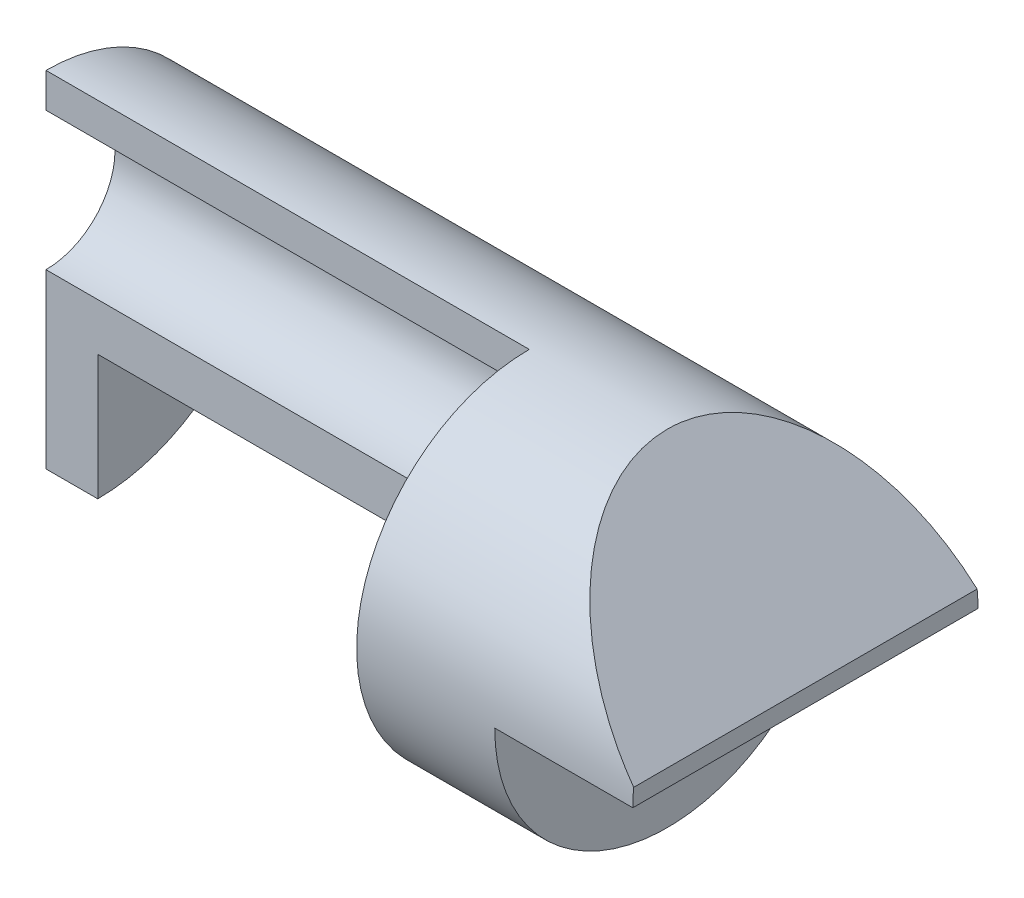
from build123d import *

# Parameters (mm, degrees)
SKETCH_1_W               = 22
SKETCH_1_H               = 5
CUT_EXTRUDE_1_DEPTH      = 24.108440017
CUT_EXTRUDE_1_DEPTH_BACK = 24.108440017
SKETCH_3_W               = 4
SKETCH_3_H               = 5
CUT_EXTRUDE_4_DEPTH      = 24.108440017
CUT_EXTRUDE_4_DEPTH_BACK = 24.108440017
SKETCH_4_W               = 14
SKETCH_4_H               = 5
CUT_EXTRUDE_5_DEPTH      = 24.108440017
CUT_EXTRUDE_5_DEPTH_BACK = 16
SKETCH_5_R               = 2
SKETCH_6_W               = 10.5
SKETCH_6_H               = 3.627911102
CUT_EXTRUDE_6_DEPTH      = 16


with BuildPart() as part:
    # 草图1 → 旋转1 (revolve)
    with BuildSketch(Plane.XY):
        with Locations((11, 2.5)):
            Rectangle(SKETCH_1_W, SKETCH_1_H)
    revolve(axis=Axis((22, 0, 0), (-1, 0, 0)))

    # 草图3 → 切除-拉伸1 (cut, two sides: drawn at the far end of the back side and taken through both)
    with BuildSketch(Plane.XY.offset(-CUT_EXTRUDE_1_DEPTH_BACK)):
        with Locations((20, -2.5)):
            Rectangle(SKETCH_3_W, SKETCH_3_H)
        Polygon((22, 0.5), (18, 5), (22, 5), align=None)
    extrude(amount=CUT_EXTRUDE_1_DEPTH + CUT_EXTRUDE_1_DEPTH_BACK, mode=Mode.SUBTRACT)

    # 草图4 → 切除-拉伸4 (cut, two sides: drawn at the far end of the back side and taken through both)
    with BuildSketch(Plane(origin=(0, 0, 0), x_dir=(1, 0, 0), z_dir=(0, 1, 0)).offset(-CUT_EXTRUDE_4_DEPTH_BACK)):
        with Locations((7, -2.5)):
            Rectangle(SKETCH_4_W, SKETCH_4_H)
    extrude(amount=CUT_EXTRUDE_4_DEPTH + CUT_EXTRUDE_4_DEPTH_BACK, mode=Mode.SUBTRACT)

    # 草图5 → 切除-拉伸5 (cut, two sides: drawn at the far end of the back side and taken through both)
    with BuildSketch(Plane.ZY.offset(-CUT_EXTRUDE_5_DEPTH_BACK)):
        with Locations(Location((0, 2, 0), (0, 0, 270))):
            Circle(SKETCH_5_R)
    extrude(amount=CUT_EXTRUDE_5_DEPTH + CUT_EXTRUDE_5_DEPTH_BACK, mode=Mode.SUBTRACT)

    # 草图6 → 切除-拉伸6 (cut)
    with BuildSketch(Plane.XY):
        with Locations((6.75, -3.186044449)):
            Rectangle(SKETCH_6_W, SKETCH_6_H)
    extrude(amount=-CUT_EXTRUDE_6_DEPTH, mode=Mode.SUBTRACT)


solid = part.part
